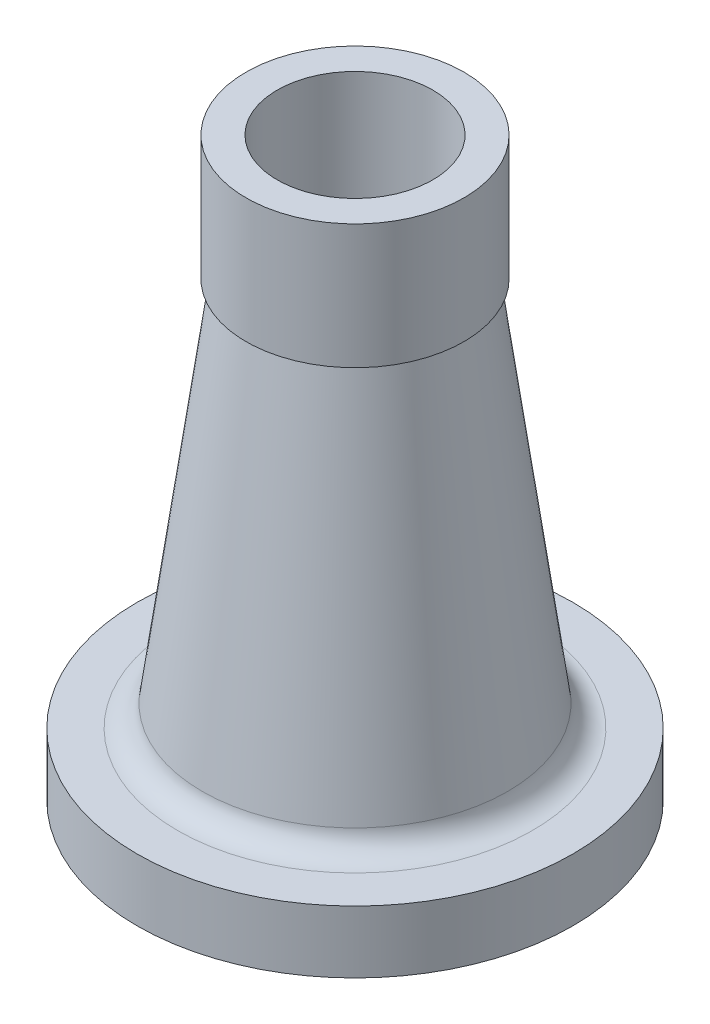
from build123d import *

# Parameters (mm, degrees)
FILLET1_R = 8


with BuildPart() as part:
    # Sketch3 → Revolve1 (revolve)
    with BuildSketch(Plane.XY, mode=Mode.PRIVATE) as revolve1_sk:
        Polygon((50, 0), (70, 0), (70, 20), (50, 20), (33, 145), (35, 145), (35, 185), (25, 185), (25, 129.61723322), (42.219943718, 3), (50, 3), align=None)
    revolve(revolve1_sk.sketch.rotate(Axis((0, 0, 0), (0, 1, 0)), 90), axis=Axis((0, 0, 0), (0, 1, 0)))

    # Fillet1
    fillet1_edges = [part.edges().sort_by_distance(p)[0] for p in [
        (0, 20, 50),
    ]]
    fillet(fillet1_edges, radius=FILLET1_R)


solid = part.part
